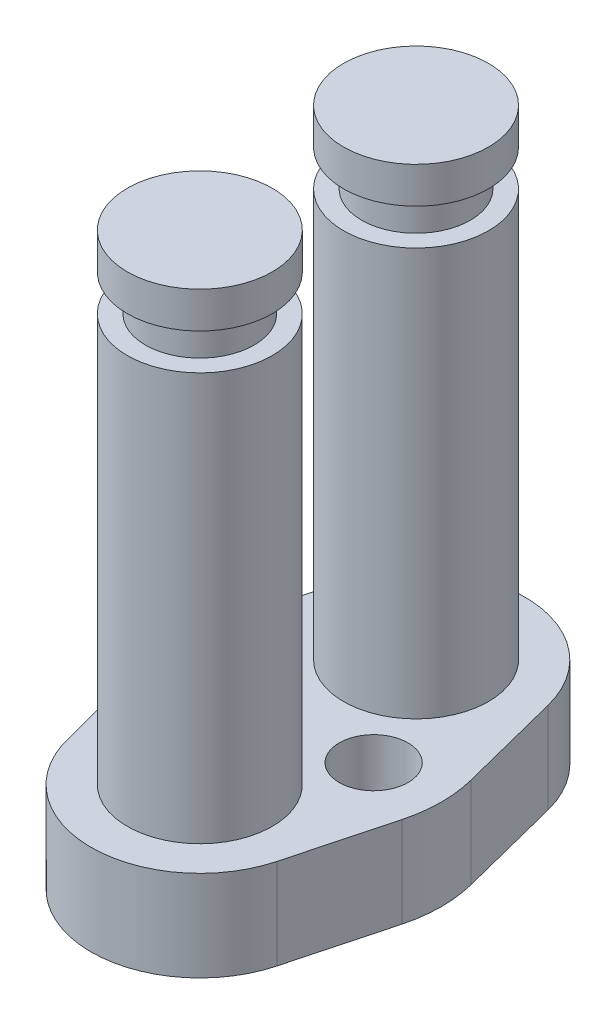
from build123d import *

# Parameters (mm, degrees)
BOSS_EXTRUDE2_DEPTH   = 5
SKETCH3_R             = 4
BOSS_EXTRUDE3_DEPTH   = 22.5
SKETCH4_R             = 3
BOSS_EXTRUDE4_DEPTH   = 2
SKETCH5_R             = 4
BOSS_EXTRUDE5_DEPTH   = 2
F_6_CLEARANCE_HOLE1_D = 3.7973


with BuildPart() as part:
    # Sketch2 → Boss-Extrude2 (new body)
    with BuildSketch(Plane(origin=(0, 0, 0), x_dir=(1, 0, 0), z_dir=(0, 1, 0))):
        with BuildLine():
            ThreePointArc((-1.921673483, -7.798539123), (3.967844549, -11.837003018), (9.548776015, -7.381801872))
            Line((9.548776015, -7.381801872), (10.998470019, -1.926053578))
            ThreePointArc((10.998470019, -1.926053578), (11.24988985, -0.04064778), (11.018921171, 1.84737246))
            Line((11.018921171, 1.84737246), (9.565136937, 7.567628243))
            ThreePointArc((9.565136937, 7.567628243), (3.75, 12.089730275), (-2.065136937, 7.567628243))
            Line((-2.065136937, 7.567628243), (-3.518921171, 1.84737246))
            ThreePointArc((-3.518921171, 1.84737246), (-3.749830525, -0.050419155), (-3.493426606, -1.944934706))
            Line((-3.493426606, -1.944934706), (-1.921673483, -7.798539123))
        make_face()
    extrude(amount=BOSS_EXTRUDE2_DEPTH)

    # Sketch3 → Boss-Extrude3 (add)
    with BuildSketch(Plane(origin=(0, 5, 0), x_dir=(1, 0, 0), z_dir=(0, 1, 0))):
        with Locations(Location((3.75, -5.840959009, 0), (0, 0, 90))):
            Circle(SKETCH3_R)
        with Locations(Location((3.75, 6.089730275, 0), (0, 0, 90))):
            Circle(SKETCH3_R)
    extrude(amount=BOSS_EXTRUDE3_DEPTH)

    # Sketch4 → Boss-Extrude4 (add)
    with BuildSketch(Plane(origin=(0, 27.5, 0), x_dir=(1, 0, 0), z_dir=(0, 1, 0))):
        with Locations(Location((3.75, -5.840959009, 0), (0, 0, 270))):
            Circle(SKETCH4_R)
        with Locations(Location((3.75, 6.089730275, 0), (0, 0, 270))):
            Circle(SKETCH4_R)
    extrude(amount=BOSS_EXTRUDE4_DEPTH)

    # Sketch5 → Boss-Extrude5 (add)
    with BuildSketch(Plane(origin=(0, 29.5, 0), x_dir=(1, 0, 0), z_dir=(0, 1, 0))):
        with Locations(Location((3.75, -5.840959009, 0), (0, 0, 90))):
            Circle(SKETCH5_R)
        with Locations(Location((3.75, 6.089730275, 0), (0, 0, 90))):
            Circle(SKETCH5_R)
    extrude(amount=BOSS_EXTRUDE5_DEPTH)

    # #6 Clearance Hole1 (through all)
    with Locations(Plane(origin=(0, 5, 0), x_dir=(1, 0, 0), z_dir=(0, 1, 0))):
        with Locations((0, 0), (7.5, 0)):
            Hole(F_6_CLEARANCE_HOLE1_D / 2)


solid = part.part
